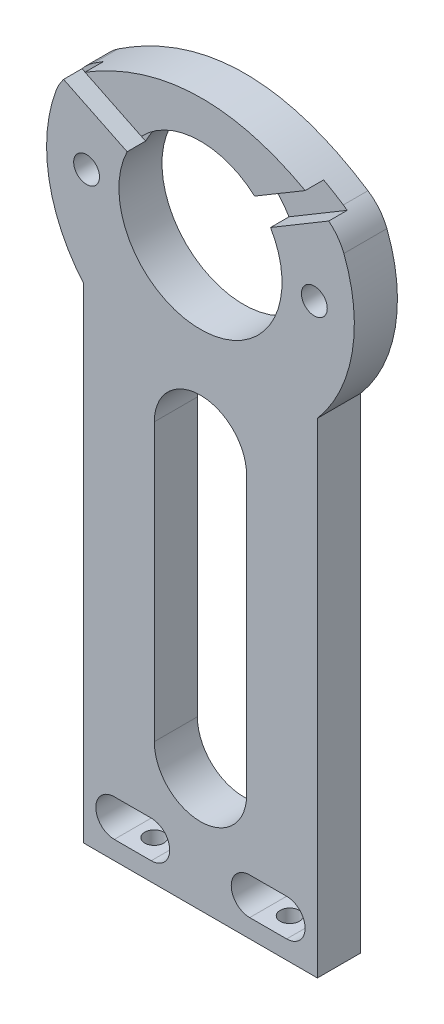
from build123d import *

# Parameters (mm, degrees)
SKETCH_1_R          = 13.25
EXTRUDE_1_DEPTH     = 3.5
SKETCH4_R           = 1.55
CUT_EXTRUDE5_DEPTH  = 5
SKETCH_2_R          = 2.1
CUT_EXTRUDE_1_DEPTH = 10
CUT_EXTRUDE_2_DEPTH = 171.144056611
FILLET_1_R          = 8
CUT_EXTRUDE_3_DEPTH = 3


with BuildPart() as part:
    # 草图1 → 凸台-拉伸1 (new, symmetric)
    with BuildSketch(Plane.XY):
        with BuildLine():
            Line((-19, 0), (19, 0))
            Line((19, 0), (19, 78.751923191))
            ThreePointArc((19, 78.751923191), (0, 120), (-19, 78.751923191))
            Line((-19, 78.751923191), (-19, 0))
        make_face()
        with BuildLine():
            ThreePointArc((-8, 9), (-5, 6), (-8, 3))
            Line((-8, 3), (-14, 3))
            ThreePointArc((-14, 3), (-17, 6), (-14, 9))
            Line((-14, 9), (-8, 9))
        make_face(mode=Mode.SUBTRACT)
        with BuildLine():
            ThreePointArc((8, 3), (5, 6), (8, 9))
            Line((8, 9), (14, 9))
            ThreePointArc((14, 9), (17, 6), (14, 3))
            Line((14, 3), (8, 3))
        make_face(mode=Mode.SUBTRACT)
        with BuildLine():
            ThreePointArc((-7.5, 65), (-5.303300859, 70.303300859), (0, 72.5))
            ThreePointArc((0, 72.5), (5.303300859, 70.303300859), (7.5, 65))
            Line((7.5, 65), (7.5, 20))
            ThreePointArc((7.5, 20), (0, 12.5), (-7.5, 20))
            Line((-7.5, 20), (-7.5, 65))
        make_face(mode=Mode.SUBTRACT)
        with Locations((0, 95)):
            Circle(SKETCH_1_R, mode=Mode.SUBTRACT)
    extrude(amount=EXTRUDE_1_DEPTH, both=True)

    # Sketch4 → Cut-Extrude5 (cut)
    with BuildSketch(Plane(origin=(0, 0, 0), x_dir=(-1, 0, 0), z_dir=(0, -1, 0))):
        with Locations(Location((11, 0, 0), (0, 0, 180))):
            Circle(SKETCH4_R)
        with Locations((-11, 0)):
            Circle(SKETCH4_R)
    extrude(amount=-CUT_EXTRUDE5_DEPTH, mode=Mode.SUBTRACT)

    # 草图2 → 切除-拉伸1 (cut)
    with BuildSketch(Plane.XY.offset(3.5)):
        with Locations((-18.5, 95)):
            Circle(SKETCH_2_R)
        with Locations((18.5, 95)):
            Circle(SKETCH_2_R)
    extrude(amount=-CUT_EXTRUDE_1_DEPTH, mode=Mode.SUBTRACT)

    # 草图4 → 切除-拉伸2 (cut, through all)
    with BuildSketch(Plane(origin=(0, 0, -114.5), x_dir=(-1, 0, 0), z_dir=(0, 0, -1))):
        with BuildLine():
            ThreePointArc((22.386292421, 106.128967232), (0.219572962, 119.999035736), (-22.187356595, 106.520469059))
            add(Edge.make_bspline(
                [(-22.187356595, 106.520469059), (0, 122.446847778), (22.386292421, 106.128967232)],
                knots=[0, 0, 0, 1, 1, 1], degree=2))
        make_face()
    extrude(amount=-CUT_EXTRUDE_2_DEPTH, mode=Mode.SUBTRACT)

    # 圆角1
    fillet_1_edges = [part.edges().sort_by_distance(p)[0] for p in [
        (-22.386292421, 106.128967232, 0),
        (22.187356595, 106.520469059, 0),
    ]]
    fillet(fillet_1_edges, radius=FILLET_1_R)

    # 草图5 → 切除-拉伸3 (cut)
    with BuildSketch(Plane.XY.offset(3.5)):
        Polygon((-22.238605802, 105.815360884), (0, 95), (-0.192853393, 99.54174681), (-22.228779927, 110.258538141), align=None)
        Polygon((-0.192853393, 99.54174681), (0, 95), (21.241716437, 107.661638988), (20.855269273, 112.087989547), align=None)
    extrude(amount=-CUT_EXTRUDE_3_DEPTH, mode=Mode.SUBTRACT)


solid = part.part
